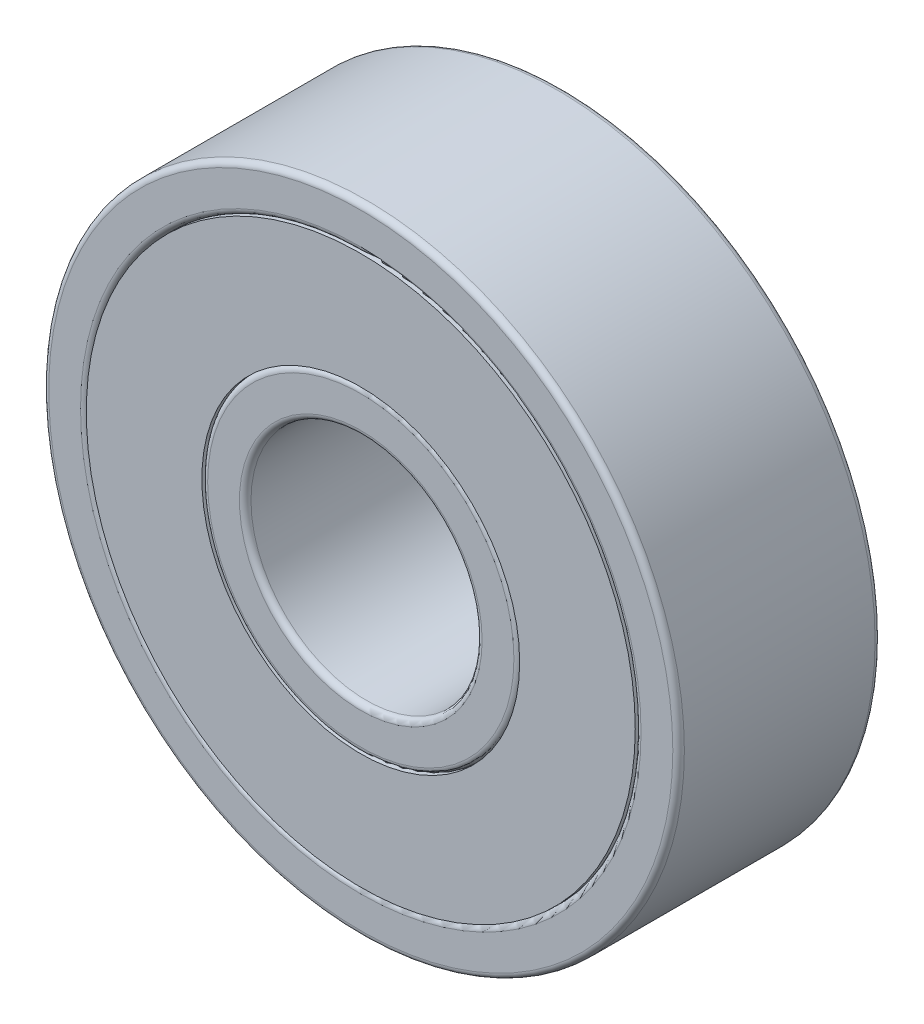
from build123d import *

# Parameters (mm, degrees)
SKETCH1_R             = 11
SKETCH1_R_2           = 9.5
BOSS_EXTRUDE1_DEPTH   = 7
SKETCH1_R_3           = 5.5
SKETCH1_R_4           = 4
BOSS_EXTRUDE1_2_DEPTH = 7
SKETCH1_3_R           = 9.5
SKETCH1_3_R_2         = 5.5
BOSS_EXTRUDE2_DEPTH   = 7
FILLET1_R             = 0.2
FILLET2_R             = 0.2


with BuildPart() as part:
    # Sketch1 → Boss-Extrude1 (new body)
    with BuildSketch(Plane.XY):
        Circle(SKETCH1_R)
        Circle(SKETCH1_R_2, mode=Mode.SUBTRACT)
    extrude(amount=BOSS_EXTRUDE1_DEPTH)

    # Fillet1
    fillet1_edges = [part.edges().sort_by_distance(p)[0] for p in [
        (-11, 0, 0),
        (-9.5, 0, 0),
        (-9.5, 0, 7),
        (-11, 0, 7),
    ]]
    fillet(fillet1_edges, radius=FILLET1_R)


with BuildPart() as body_2:
    # Sketch1 → Boss-Extrude1 2 (new body)
    with BuildSketch(Plane.XY):
        Circle(SKETCH1_R_3)
        Circle(SKETCH1_R_4, mode=Mode.SUBTRACT)
    extrude(amount=BOSS_EXTRUDE1_2_DEPTH)

    # Fillet2
    fillet2_edges = [body_2.edges().sort_by_distance(p)[0] for p in [
        (-5.5, 0, 0),
        (-4, 0, 0),
        (-4, 0, 7),
        (-5.5, 0, 7),
    ]]
    fillet(fillet2_edges, radius=FILLET2_R)


with BuildPart() as body_3:
    # Sketch1<3> → Boss-Extrude2 (new body)
    with BuildSketch(Plane.XY):
        Circle(SKETCH1_3_R)
        Circle(SKETCH1_3_R_2, mode=Mode.SUBTRACT)
    extrude(amount=BOSS_EXTRUDE2_DEPTH)


solid = Compound([part.part, body_2.part, body_3.part])
